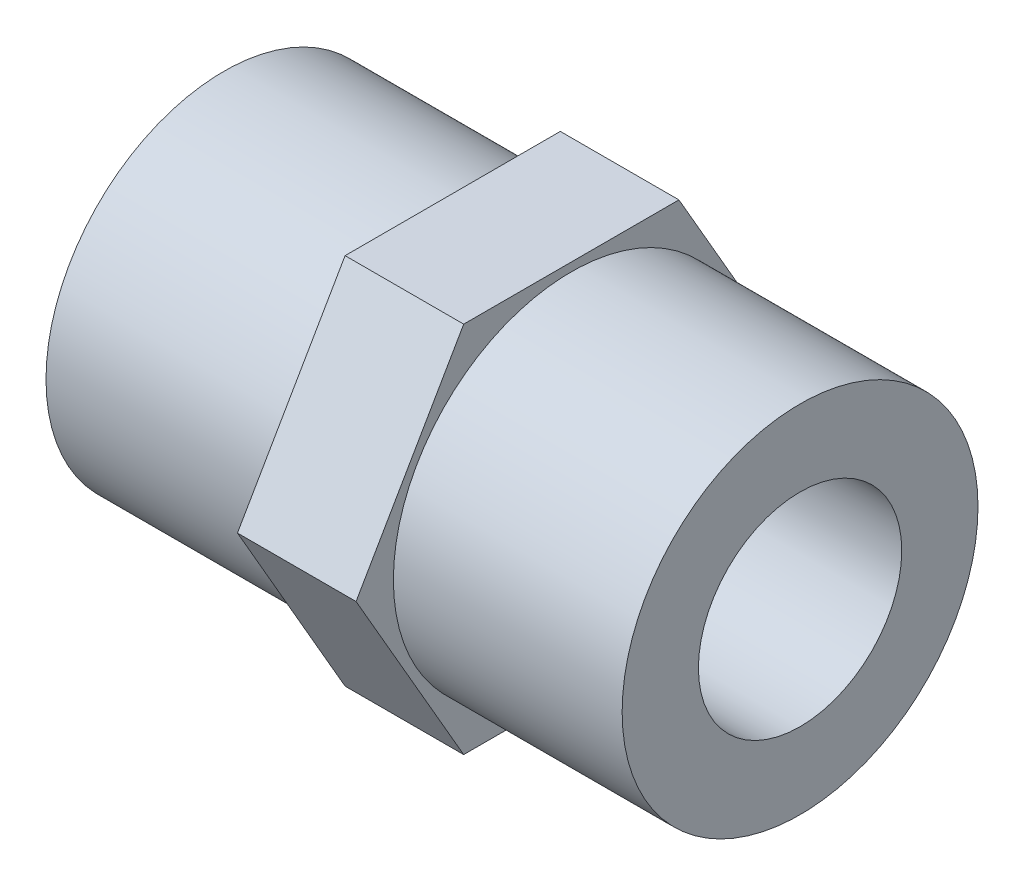
from build123d import *

# Parameters (mm, degrees)
ESTRUSIONE_ESTRUSIONE1_DEPTH = 7


with BuildPart() as part:
    # Schizzo1 → Rivoluzione1 (revolve)
    with BuildSketch(Plane.XY, mode=Mode.PRIVATE) as rivoluzione1_sk:
        Polygon((0, 6), (0, 10.5), (13.5, 10.5), (13.5, 11), (20.5, 11), (20.5, 10.5), (34, 10.5), (34, 6), align=None)
    revolve(rivoluzione1_sk.sketch.rotate(Axis((0, 0, 0), (1, 0, 0)), 90), axis=Axis((0, 0, 0), (1, 0, 0)))

    # Schizzo2 → Estrusione-Estrusione1 (add)
    with BuildSketch(Plane(origin=(20.5, 0, 0), x_dir=(0, 0, -1), z_dir=(1, 0, 0))):
        with BuildLine():
            Line((-9.526279218, 5.500000386), (-12.701705922, 0))
            Line((-12.701705922, 0), (-9.526279182, -5.50000045))
            ThreePointArc((-9.526279182, -5.50000045), (-11, -3.7e-08), (-9.526279218, 5.500000386))
        make_face()
        with BuildLine():
            Line((-6.350852961, 11), (-9.526279218, 5.500000386))
            ThreePointArc((-9.526279218, 5.500000386), (-5.499999807, 9.526279553), (0, 11))
            Line((0, 11), (-6.350852961, 11))
        make_face()
        with BuildLine():
            Line((6.350852961, 11), (0, 11))
            ThreePointArc((0, 11), (5.499999692, 9.526279619), (9.526279086, 5.500000616))
            Line((9.526279086, 5.500000616), (6.350852961, 11))
        make_face()
        with BuildLine():
            ThreePointArc((0, -11), (-5.499999775, -9.526279572), (-9.526279182, -5.50000045))
            Line((-9.526279182, -5.50000045), (-6.350852961, -11))
            Line((-6.350852961, -11), (0, -11))
        make_face()
        with BuildLine():
            ThreePointArc((9.526279182, -5.50000045), (5.499999775, -9.526279572), (0, -11))
            Line((0, -11), (6.350852961, -11))
            Line((6.350852961, -11), (9.526279182, -5.50000045))
        make_face()
        with BuildLine():
            ThreePointArc((11, 0), (10.625184022, -2.847009747), (9.526279182, -5.50000045))
            Line((9.526279182, -5.50000045), (12.701705922, 0))
            Line((12.701705922, 0), (9.526279086, 5.500000616))
            ThreePointArc((9.526279086, 5.500000616), (10.625183997, 2.84700984), (11, 0))
        make_face()
    extrude(amount=-ESTRUSIONE_ESTRUSIONE1_DEPTH)


solid = part.part
